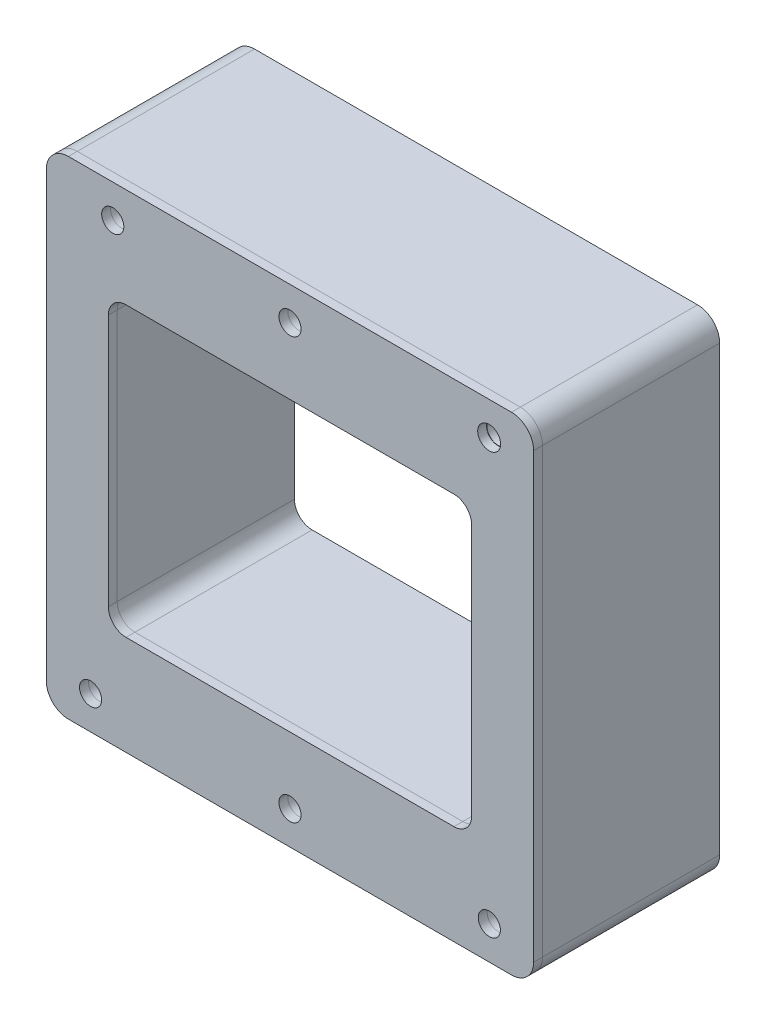
from build123d import *

# Parameters (mm, degrees)
CROQUIS2_R              = 2.5
SALIENTE_EXTRUIR1_DEPTH = 40
CROQUIS3_R              = 2.5
CROQUIS3_R_2            = 2.585039772
SALIENTE_EXTRUIR2_DEPTH = 2


with BuildPart() as part:
    # Croquis2 → Saliente-Extruir1 (new body)
    with BuildSketch(Plane.XY):
        with BuildLine():
            Line((643.862272549, 841.557366956), (743.862272549, 841.557366956))
            ThreePointArc((743.862272549, 841.557366956), (747.397806455, 843.02183305), (748.862272549, 846.557366956))
            Line((748.862272549, 846.557366956), (748.862272549, 946.557366956))
            ThreePointArc((748.862272549, 946.557366956), (747.397806455, 950.092900862), (743.862272549, 951.557366956))
            Line((743.862272549, 951.557366956), (643.862272549, 951.557366956))
            ThreePointArc((643.862272549, 951.557366956), (640.326738643, 950.092900862), (638.862272549, 946.557366956))
            Line((638.862272549, 946.557366956), (638.862272549, 846.557366956))
            ThreePointArc((638.862272549, 846.557366956), (640.326738643, 843.02183305), (643.862272549, 841.557366956))
        make_face()
        with Locations((693.862272549, 944.057366956)):
            Circle(CROQUIS2_R, mode=Mode.SUBTRACT)
        with Locations((653.862272549, 944.057366956)):
            Circle(CROQUIS2_R, mode=Mode.SUBTRACT)
        with Locations((738.82139492, 944.080684435)):
            Circle(CROQUIS2_R, mode=Mode.SUBTRACT)
        with Locations((738.862272549, 849.057366956)):
            Circle(CROQUIS2_R, mode=Mode.SUBTRACT)
        with Locations((693.862272549, 849.057366956)):
            Circle(CROQUIS2_R, mode=Mode.SUBTRACT)
        with Locations((648.862272549, 849.057366956)):
            Circle(CROQUIS2_R, mode=Mode.SUBTRACT)
        with BuildLine():
            Line((734.865717045, 868.057366956), (734.865717045, 925.057366956))
            ThreePointArc((734.865717045, 925.057366956), (733.69414417, 927.885794081), (730.865717045, 929.057366956))
            Line((730.865717045, 929.057366956), (656.865717045, 929.057366956))
            ThreePointArc((656.865717045, 929.057366956), (654.03728992, 927.885794081), (652.865717045, 925.057366956))
            Line((652.865717045, 925.057366956), (652.865717045, 868.057366956))
            ThreePointArc((652.865717045, 868.057366956), (654.03728992, 865.228939831), (656.865717045, 864.057366956))
            Line((656.865717045, 864.057366956), (730.865717045, 864.057366956))
            ThreePointArc((730.865717045, 864.057366956), (733.69414417, 865.228939831), (734.865717045, 868.057366956))
        make_face(mode=Mode.SUBTRACT)
    extrude(amount=SALIENTE_EXTRUIR1_DEPTH)


with BuildPart() as body_2:
    # Croquis3 → Saliente-Extruir2 (new body)
    with BuildSketch(Plane.XY.offset(40)):
        with BuildLine():
            Line((643.862272549, 841.557366956), (743.862272549, 841.557366956))
            ThreePointArc((743.862272549, 841.557366956), (747.397806455, 843.02183305), (748.862272549, 846.557366956))
            Line((748.862272549, 846.557366956), (748.862272549, 946.557366956))
            ThreePointArc((748.862272549, 946.557366956), (747.397806455, 950.092900862), (743.862272549, 951.557366956))
            Line((743.862272549, 951.557366956), (643.862272549, 951.557366956))
            ThreePointArc((643.862272549, 951.557366956), (640.326738643, 950.092900862), (638.862272549, 946.557366956))
            Line((638.862272549, 946.557366956), (638.862272549, 846.557366956))
            ThreePointArc((638.862272549, 846.557366956), (640.326738643, 843.02183305), (643.862272549, 841.557366956))
        make_face()
        with Locations((653.862272549, 944.057366956)):
            Circle(CROQUIS3_R, mode=Mode.SUBTRACT)
        with Locations((693.862272549, 944.057366956)):
            Circle(CROQUIS3_R, mode=Mode.SUBTRACT)
        with Locations((738.82139492, 944.080684435)):
            Circle(CROQUIS3_R_2, mode=Mode.SUBTRACT)
        with Locations((738.862272549, 849.057366956)):
            Circle(CROQUIS3_R, mode=Mode.SUBTRACT)
        with Locations((693.862272549, 849.057366956)):
            Circle(CROQUIS3_R, mode=Mode.SUBTRACT)
        with Locations((648.862272549, 849.057366956)):
            Circle(CROQUIS3_R, mode=Mode.SUBTRACT)
        with BuildLine():
            Line((730.865717045, 929.057366956), (656.865717045, 929.057366956))
            ThreePointArc((656.865717045, 929.057366956), (654.03728992, 927.885794081), (652.865717045, 925.057366956))
            Line((652.865717045, 925.057366956), (652.865717045, 868.057366956))
            ThreePointArc((652.865717045, 868.057366956), (654.03728992, 865.228939831), (656.865717045, 864.057366956))
            Line((656.865717045, 864.057366956), (730.865717045, 864.057366956))
            ThreePointArc((730.865717045, 864.057366956), (733.69414417, 865.228939831), (734.865717045, 868.057366956))
            Line((734.865717045, 868.057366956), (734.865717045, 925.057366956))
            ThreePointArc((734.865717045, 925.057366956), (733.69414417, 927.885794081), (730.865717045, 929.057366956))
        make_face(mode=Mode.SUBTRACT)
    extrude(amount=SALIENTE_EXTRUIR2_DEPTH)


solid = Compound([part.part, body_2.part])
